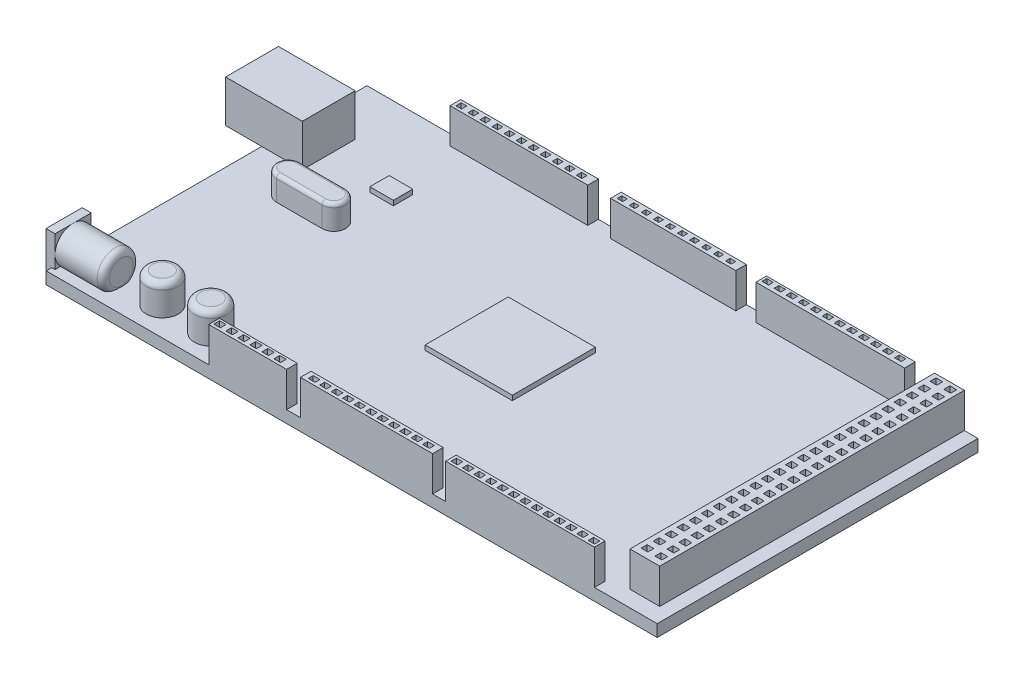
from build123d import *

# Parameters (mm, degrees)
SKETCH1_W            = 101.52
SKETCH1_H            = 53.3
BOSS_EXTRUDE1_DEPTH  = 2
SKETCH2_W            = 6.74838085
SKETCH2_H            = 8.78064323
BOSS_EXTRUDE2_DEPTH  = 7
SKETCH3_W            = 8.78064323
SKETCH3_H            = 7
BOSS_EXTRUDE3_DEPTH  = 6
SKETCH4_W            = 4.543302896
SKETCH4_H            = 1.024447778
CUT_EXTRUDE1_DEPTH   = 10
SKETCH5_R            = 3
BOSS_EXTRUDE4_DEPTH  = 8
FILLET1_R            = 1
SKETCH6_W            = 6
SKETCH6_H            = 6
BOSS_EXTRUDE6_DEPTH  = 1.5
SKETCH8_R            = 2.5
SKETCH8_R_2          = 0.349668819
CUT_EXTRUDE5_DEPTH   = 6
SKETCH9_R            = 2.653495426
SKETCH9_R_2          = 2.712578632
BOSS_EXTRUDE7_DEPTH  = 5
FILLET2_R            = 1
BOSS_EXTRUDE8_DEPTH  = 4
FILLET3_R            = 0.6
SKETCH11_W           = 14.481891317
SKETCH11_H           = 13.792277445
SKETCH11_W_2         = 3.907811942
SKETCH11_H_2         = 3.21819807
BOSS_EXTRUDE9_DEPTH  = 0.8
SKETCH12_W           = 22.872193429
SKETCH12_H           = 1.77
SKETCH12_W_2         = 20.803351813
SKETCH12_W_3         = 24.711163755
SKETCH12_W_4         = 4.942232752
SKETCH12_H_2         = 50.614069561
SKETCH12_W_5         = 21.952708267
SKETCH12_W_6         = 12.930260105
BOSS_EXTRUDE10_DEPTH = 5.8
SKETCH13_W           = 0.927290968
SKETCH13_H           = 0.87274444
CUT_EXTRUDE6_DEPTH   = 4.8
SKETCH14_W           = 0.905472357
SKETCH14_H           = 0.769651504
CUT_EXTRUDE7_DEPTH   = 3.8
SKETCH15_W           = 1.089735982
SKETCH15_H           = 0.789119159
CUT_EXTRUDE8_DEPTH   = 3.8
SKETCH17_W           = 1.087248378
SKETCH17_H           = 0.957814047
CUT_EXTRUDE9_DEPTH   = 3.8
SKETCH18_W           = 1.127313084
SKETCH18_H           = 0.826696262
CUT_EXTRUDE10_DEPTH  = 3.8
SKETCH19_W           = 1.047751564
SKETCH19_H           = 0.893670451
CUT_EXTRUDE11_DEPTH  = 3.8
SKETCH20_W           = 1.131840446
SKETCH20_H           = 0.996019593
CUT_EXTRUDE12_DEPTH  = 3.8


with BuildPart() as part:
    # Sketch1 → Boss-Extrude1 (new body)
    with BuildSketch(Plane(origin=(0, 0, 0), x_dir=(1, 0, 0), z_dir=(0, 1, 0))):
        with Locations((-2.786348449, 3.030668258)):
            Rectangle(SKETCH1_W, SKETCH1_H)
    extrude(amount=BOSS_EXTRUDE1_DEPTH)

    # Sketch2 → Boss-Extrude2 (add)
    with BuildSketch(Plane(origin=(0, 2, 0), x_dir=(1, 0, 0), z_dir=(0, 1, 0))):
        with Locations((-50.172158024, 16.581043612)):
            Rectangle(SKETCH2_W, SKETCH2_H)
    extrude(amount=BOSS_EXTRUDE2_DEPTH)

    # Sketch3 → Boss-Extrude3 (add)
    with BuildSketch(Plane.ZY.offset(53.546348449)):
        with Locations((-16.581043612, 5.5)):
            Rectangle(SKETCH3_W, SKETCH3_H)
    extrude(amount=BOSS_EXTRUDE3_DEPTH)

    # Sketch4 → Cut-Extrude1 (cut)
    with BuildSketch(Plane.ZY.offset(59.546348449)):
        Polygon((-14.309392164, 7.943282811), (-18.85269506, 7.943282811), (-20.446280493, 6.349697378), (-20.446280493, 2.991785215), (-12.71580673, 2.991785215), (-12.71580673, 6.349697378), align=None)
        with Locations((-16.581043612, 5.154508303)):
            Rectangle(SKETCH4_W, SKETCH4_H, mode=Mode.SUBTRACT)
    extrude(amount=-CUT_EXTRUDE1_DEPTH, mode=Mode.SUBTRACT)


with BuildPart() as body_2:
    # Sketch5 → Boss-Extrude4 (new body)
    with BuildSketch(Plane(origin=(-45, 0, 0), x_dir=(0, 0, -1), z_dir=(1, 0, 0))):
        with Locations((-19.694998297, 4.155671719)):
            Circle(SKETCH5_R)
    extrude(amount=-BOSS_EXTRUDE4_DEPTH)

    # Fillet1
    fillet1_edges = [body_2.edges().sort_by_distance(p)[0] for p in [
        (-45, 4.155671719, 22.694998297),
    ]]
    fillet(fillet1_edges, radius=FILLET1_R)


with BuildPart() as body_3:
    # Sketch6 → Boss-Extrude6 (new body)
    with BuildSketch(Plane.ZY.offset(53)):
        with Locations((19.694998297, 4.155671719)):
            Rectangle(SKETCH6_W, SKETCH6_H)
    extrude(amount=BOSS_EXTRUDE6_DEPTH)


with BuildPart() as cut_extrude5_tool:
    # Sketch8 → Cut-Extrude5 (new body)
    with BuildSketch(Plane.ZY.offset(54.5)):
        with Locations((19.694998297, 4.155671719)):
            Circle(SKETCH8_R)
        with Locations((19.694998297, 4.155671719)):
            Circle(SKETCH8_R_2, mode=Mode.SUBTRACT)
    extrude(amount=-CUT_EXTRUDE5_DEPTH)


with BuildPart() as part_1:
    add(part.part)

    # Cut-Extrude5: cut by cut_extrude5_tool
    add(cut_extrude5_tool.part, mode=Mode.SUBTRACT)

    # Sketch9 → Boss-Extrude7 (add)
    with BuildSketch(Plane(origin=(0, 2, 0), x_dir=(1, 0, 0), z_dir=(0, 1, 0))):
        with Locations(Location((-39.002762462, -18.864559686, 0), (0, 0, 270))):
            Circle(SKETCH9_R)
        with Locations(Location((-30.957267285, -18.864559686, 0), (0, 0, 270))):
            Circle(SKETCH9_R_2)
    extrude(amount=BOSS_EXTRUDE7_DEPTH)

    # Fillet2
    fillet2_edges = [part_1.edges().sort_by_distance(p)[0] for p in [
        (-39.002762462, 7, 16.21106426),
        (-30.957267285, 7, 16.151981054),
    ]]
    fillet(fillet2_edges, radius=FILLET2_R)

    # Sketch10 → Boss-Extrude8 (add)
    with BuildSketch(Plane(origin=(0, 2, 0), x_dir=(1, 0, 0), z_dir=(0, 1, 0))):
        with BuildLine():
            Line((-44.289802149, 9.294673431), (-36.704049554, 9.294673431))
            ThreePointArc((-36.704049554, 9.294673431), (-34.750143583, 7.340767459), (-36.704049554, 5.386861488))
            Line((-36.704049554, 5.386861488), (-44.289802149, 5.386861488))
            ThreePointArc((-44.289802149, 5.386861488), (-46.24370812, 7.340767459), (-44.289802149, 9.294673431))
        make_face()
    extrude(amount=BOSS_EXTRUDE8_DEPTH)

    # Fillet3
    fillet3_edges = [part_1.edges().sort_by_distance(p)[0] for p in [
        (-46.24370812, 6, -7.340767459),
        (-40.496925851, 6, -5.386861488),
        (-34.750143583, 6, -7.340767459),
        (-40.496925851, 6, -9.294673431),
    ]]
    fillet(fillet3_edges, radius=FILLET3_R)

    # Sketch11 → Boss-Extrude9 (add)
    with BuildSketch(Plane(origin=(0, 2, 0), x_dir=(1, 0, 0), z_dir=(0, 1, 0))):
        with Locations((-3.372712395, 3.318019872)):
            Rectangle(SKETCH11_W, SKETCH11_H)
        with Locations((-36.014435682, 16.190812153)):
            Rectangle(SKETCH11_W_2, SKETCH11_H_2)
    extrude(amount=BOSS_EXTRUDE9_DEPTH)

    # Sketch12 → Boss-Extrude10 (add)
    with BuildSketch(Plane(origin=(0, 2, 0), x_dir=(1, 0, 0), z_dir=(0, 1, 0))):
        with Locations((-26.532244938, 28.795668258)):
            Rectangle(SKETCH12_W, SKETCH12_H)
        with Locations((-0.901596021, 28.795668258)):
            Rectangle(SKETCH12_W_2, SKETCH12_H)
        with Locations((25.18879548, 28.795668258)):
            Rectangle(SKETCH12_W_3, SKETCH12_H)
        with Locations((43.233691803, 4.373633478)):
            Rectangle(SKETCH12_W_4, SKETCH12_H_2)
        with Locations((25.18879548, -22.734331742)):
            Rectangle(SKETCH12_W_3, SKETCH12_H)
        with Locations((-0.326917793, -22.734331742)):
            Rectangle(SKETCH12_W_5, SKETCH12_H)
        with Locations((-20.067114887, -22.734331742)):
            Rectangle(SKETCH12_W_6, SKETCH12_H)
    extrude(amount=BOSS_EXTRUDE10_DEPTH)

    # Sketch13 → Cut-Extrude6 (cut)
    with BuildSketch(Plane(origin=(0, 7.8, 0), x_dir=(1, 0, 0), z_dir=(0, 1, 0))):
        with Locations((-34.99503549, 28.806813689)):
            Rectangle(SKETCH13_W, SKETCH13_H)
        with Locations((-36.99503549, 28.806813689)):
            Rectangle(SKETCH13_W, SKETCH13_H)
        with Locations((-32.99503549, 28.806813689)):
            Rectangle(SKETCH13_W, SKETCH13_H)
        with Locations((-30.99503549, 28.806813689)):
            Rectangle(SKETCH13_W, SKETCH13_H)
        with Locations((-28.99503549, 28.806813689)):
            Rectangle(SKETCH13_W, SKETCH13_H)
        with Locations((-26.99503549, 28.806813689)):
            Rectangle(SKETCH13_W, SKETCH13_H)
        with Locations((-24.99503549, 28.806813689)):
            Rectangle(SKETCH13_W, SKETCH13_H)
        with Locations((-22.99503549, 28.806813689)):
            Rectangle(SKETCH13_W, SKETCH13_H)
        with Locations((-20.99503549, 28.806813689)):
            Rectangle(SKETCH13_W, SKETCH13_H)
        with Locations((-18.99503549, 28.806813689)):
            Rectangle(SKETCH13_W, SKETCH13_H)
        with Locations((-16.99503549, 28.806813689)):
            Rectangle(SKETCH13_W, SKETCH13_H)
    extrude(amount=-CUT_EXTRUDE6_DEPTH, mode=Mode.SUBTRACT)

    # Sketch14 → Cut-Extrude7 (cut)
    with BuildSketch(Plane(origin=(0, 7.8, 0), x_dir=(1, 0, 0), z_dir=(0, 1, 0))):
        with Locations((-8.279975456, 28.830261771)):
            Rectangle(SKETCH14_W, SKETCH14_H)
        with Locations((-10.279975456, 28.830261771)):
            Rectangle(SKETCH14_W, SKETCH14_H)
        with Locations((-6.279975456, 28.830261771)):
            Rectangle(SKETCH14_W, SKETCH14_H)
        with Locations((-4.279975456, 28.830261771)):
            Rectangle(SKETCH14_W, SKETCH14_H)
        with Locations((-2.279975456, 28.830261771)):
            Rectangle(SKETCH14_W, SKETCH14_H)
        with Locations((-0.279975456, 28.830261771)):
            Rectangle(SKETCH14_W, SKETCH14_H)
        with Locations((1.720024545, 28.830261771)):
            Rectangle(SKETCH14_W, SKETCH14_H)
        with Locations((3.720024545, 28.830261771)):
            Rectangle(SKETCH14_W, SKETCH14_H)
        with Locations((5.720024545, 28.830261771)):
            Rectangle(SKETCH14_W, SKETCH14_H)
        with Locations((7.720024545, 28.830261771)):
            Rectangle(SKETCH14_W, SKETCH14_H)
    extrude(amount=-CUT_EXTRUDE7_DEPTH, mode=Mode.SUBTRACT)

    # Sketch15 → Cut-Extrude8 (cut)
    with BuildSketch(Plane(origin=(0, 7.8, 0), x_dir=(1, 0, 0), z_dir=(0, 1, 0))):
        with Locations((15.773973887, 28.943664547)):
            Rectangle(SKETCH15_W, SKETCH15_H)
        with Locations((13.773973887, 28.943664547)):
            Rectangle(SKETCH15_W, SKETCH15_H)
        with Locations((17.773973887, 28.943664547)):
            Rectangle(SKETCH15_W, SKETCH15_H)
        with Locations((19.773973887, 28.943664547)):
            Rectangle(SKETCH15_W, SKETCH15_H)
        with Locations((21.773973887, 28.943664547)):
            Rectangle(SKETCH15_W, SKETCH15_H)
        with Locations((23.773973887, 28.943664547)):
            Rectangle(SKETCH15_W, SKETCH15_H)
        with Locations((25.773973887, 28.943664547)):
            Rectangle(SKETCH15_W, SKETCH15_H)
        with Locations((27.773973887, 28.943664547)):
            Rectangle(SKETCH15_W, SKETCH15_H)
        with Locations((29.773973887, 28.943664547)):
            Rectangle(SKETCH15_W, SKETCH15_H)
        with Locations((31.773973887, 28.943664547)):
            Rectangle(SKETCH15_W, SKETCH15_H)
        with Locations((33.773973887, 28.943664547)):
            Rectangle(SKETCH15_W, SKETCH15_H)
        with Locations((35.773973887, 28.943664547)):
            Rectangle(SKETCH15_W, SKETCH15_H)
    extrude(amount=-CUT_EXTRUDE8_DEPTH, mode=Mode.SUBTRACT)

    # Sketch17 → Cut-Extrude9 (cut)
    with BuildSketch(Plane(origin=(0, 7.8, 0), x_dir=(1, 0, 0), z_dir=(0, 1, 0))):
        with Locations((-23.627930838, -22.669635852)):
            Rectangle(SKETCH17_W, SKETCH17_H)
        with Locations((-25.627930838, -22.669635852)):
            Rectangle(SKETCH17_W, SKETCH17_H)
        with Locations((-21.627930838, -22.669635852)):
            Rectangle(SKETCH17_W, SKETCH17_H)
        with Locations((-19.627930838, -22.669635852)):
            Rectangle(SKETCH17_W, SKETCH17_H)
        with Locations((-17.627930838, -22.669635852)):
            Rectangle(SKETCH17_W, SKETCH17_H)
        with Locations((-15.627930838, -22.669635852)):
            Rectangle(SKETCH17_W, SKETCH17_H)
    extrude(amount=-CUT_EXTRUDE9_DEPTH, mode=Mode.SUBTRACT)

    # Sketch18 → Cut-Extrude10 (cut)
    with BuildSketch(Plane(origin=(0, 7.8, 0), x_dir=(1, 0, 0), z_dir=(0, 1, 0))):
        with Locations((-8.036156834, -22.710778398)):
            Rectangle(SKETCH18_W, SKETCH18_H)
        with Locations((-9.936156834, -22.710778398)):
            Rectangle(SKETCH18_W, SKETCH18_H)
        with Locations((-6.136156834, -22.710778398)):
            Rectangle(SKETCH18_W, SKETCH18_H)
        with Locations((-4.236156834, -22.710778398)):
            Rectangle(SKETCH18_W, SKETCH18_H)
        with Locations((-2.336156834, -22.710778398)):
            Rectangle(SKETCH18_W, SKETCH18_H)
        with Locations((-0.436156834, -22.710778398)):
            Rectangle(SKETCH18_W, SKETCH18_H)
        with Locations((1.463843166, -22.710778398)):
            Rectangle(SKETCH18_W, SKETCH18_H)
        with Locations((3.363843166, -22.710778398)):
            Rectangle(SKETCH18_W, SKETCH18_H)
        with Locations((5.263843166, -22.710778398)):
            Rectangle(SKETCH18_W, SKETCH18_H)
        with Locations((7.163843166, -22.710778398)):
            Rectangle(SKETCH18_W, SKETCH18_H)
        with Locations((9.063843166, -22.710778398)):
            Rectangle(SKETCH18_W, SKETCH18_H)
    extrude(amount=-CUT_EXTRUDE10_DEPTH, mode=Mode.SUBTRACT)

    # Sketch19 → Cut-Extrude11 (cut)
    with BuildSketch(Plane(origin=(0, 7.8, 0), x_dir=(1, 0, 0), z_dir=(0, 1, 0))):
        with Locations((15.696618829, -22.731537289)):
            Rectangle(SKETCH19_W, SKETCH19_H)
        with Locations((13.796618829, -22.731537289)):
            Rectangle(SKETCH19_W, SKETCH19_H)
        with Locations((17.596618829, -22.731537289)):
            Rectangle(SKETCH19_W, SKETCH19_H)
        with Locations((19.496618829, -22.731537289)):
            Rectangle(SKETCH19_W, SKETCH19_H)
        with Locations((21.396618829, -22.731537289)):
            Rectangle(SKETCH19_W, SKETCH19_H)
        with Locations((23.296618829, -22.731537289)):
            Rectangle(SKETCH19_W, SKETCH19_H)
        with Locations((25.196618829, -22.731537289)):
            Rectangle(SKETCH19_W, SKETCH19_H)
        with Locations((27.096618829, -22.731537289)):
            Rectangle(SKETCH19_W, SKETCH19_H)
        with Locations((28.996618829, -22.731537289)):
            Rectangle(SKETCH19_W, SKETCH19_H)
        with Locations((30.896618829, -22.731537289)):
            Rectangle(SKETCH19_W, SKETCH19_H)
        with Locations((32.796618829, -22.731537289)):
            Rectangle(SKETCH19_W, SKETCH19_H)
        with Locations((34.696618829, -22.731537289)):
            Rectangle(SKETCH19_W, SKETCH19_H)
        with Locations((36.596618829, -22.731537289)):
            Rectangle(SKETCH19_W, SKETCH19_H)
    extrude(amount=-CUT_EXTRUDE11_DEPTH, mode=Mode.SUBTRACT)

    # Sketch20 → Cut-Extrude12 (cut)
    with BuildSketch(Plane(origin=(0, 7.8, 0), x_dir=(1, 0, 0), z_dir=(0, 1, 0))):
        with Locations((44.42776347, 28.61232489)):
            Rectangle(SKETCH20_W, SKETCH20_H)
        with Locations((42.12776347, 28.61232489)):
            Rectangle(SKETCH20_W, SKETCH20_H)
        with Locations((44.42776347, 26.61232489)):
            Rectangle(SKETCH20_W, SKETCH20_H)
        with Locations((44.42776347, 24.61232489)):
            Rectangle(SKETCH20_W, SKETCH20_H)
        with Locations((44.42776347, 22.61232489)):
            Rectangle(SKETCH20_W, SKETCH20_H)
        with Locations((44.42776347, 20.61232489)):
            Rectangle(SKETCH20_W, SKETCH20_H)
        with Locations((44.42776347, 18.61232489)):
            Rectangle(SKETCH20_W, SKETCH20_H)
        with Locations((44.42776347, 16.61232489)):
            Rectangle(SKETCH20_W, SKETCH20_H)
        with Locations((44.42776347, 14.61232489)):
            Rectangle(SKETCH20_W, SKETCH20_H)
        with Locations((44.42776347, 12.61232489)):
            Rectangle(SKETCH20_W, SKETCH20_H)
        with Locations((44.42776347, 10.612324889)):
            Rectangle(SKETCH20_W, SKETCH20_H)
        with Locations((44.42776347, 8.612324889)):
            Rectangle(SKETCH20_W, SKETCH20_H)
        with Locations((44.42776347, 6.612324889)):
            Rectangle(SKETCH20_W, SKETCH20_H)
        with Locations((44.42776347, 4.612324889)):
            Rectangle(SKETCH20_W, SKETCH20_H)
        with Locations((44.42776347, 2.612324889)):
            Rectangle(SKETCH20_W, SKETCH20_H)
        with Locations((44.42776347, 0.61232489)):
            Rectangle(SKETCH20_W, SKETCH20_H)
        with Locations((44.42776347, -1.387675111)):
            Rectangle(SKETCH20_W, SKETCH20_H)
        with Locations((44.42776347, -3.387675111)):
            Rectangle(SKETCH20_W, SKETCH20_H)
        with Locations((44.42776347, -5.387675111)):
            Rectangle(SKETCH20_W, SKETCH20_H)
        with Locations((44.42776347, -7.387675111)):
            Rectangle(SKETCH20_W, SKETCH20_H)
        with Locations((44.42776347, -9.387675111)):
            Rectangle(SKETCH20_W, SKETCH20_H)
        with Locations((44.42776347, -11.387675111)):
            Rectangle(SKETCH20_W, SKETCH20_H)
        with Locations((44.42776347, -13.387675111)):
            Rectangle(SKETCH20_W, SKETCH20_H)
        with Locations((44.42776347, -15.387675111)):
            Rectangle(SKETCH20_W, SKETCH20_H)
        with Locations((44.42776347, -17.387675111)):
            Rectangle(SKETCH20_W, SKETCH20_H)
        with Locations((44.42776347, -19.387675111)):
            Rectangle(SKETCH20_W, SKETCH20_H)
        with Locations((42.12776347, 26.61232489)):
            Rectangle(SKETCH20_W, SKETCH20_H)
        with Locations((42.12776347, 24.61232489)):
            Rectangle(SKETCH20_W, SKETCH20_H)
        with Locations((42.12776347, 22.61232489)):
            Rectangle(SKETCH20_W, SKETCH20_H)
        with Locations((42.12776347, 20.61232489)):
            Rectangle(SKETCH20_W, SKETCH20_H)
        with Locations((42.12776347, 18.61232489)):
            Rectangle(SKETCH20_W, SKETCH20_H)
        with Locations((42.12776347, 16.61232489)):
            Rectangle(SKETCH20_W, SKETCH20_H)
        with Locations((42.12776347, 14.61232489)):
            Rectangle(SKETCH20_W, SKETCH20_H)
        with Locations((42.12776347, 12.61232489)):
            Rectangle(SKETCH20_W, SKETCH20_H)
        with Locations((42.12776347, 10.612324889)):
            Rectangle(SKETCH20_W, SKETCH20_H)
        with Locations((42.12776347, 8.612324889)):
            Rectangle(SKETCH20_W, SKETCH20_H)
        with Locations((42.12776347, 6.612324889)):
            Rectangle(SKETCH20_W, SKETCH20_H)
        with Locations((42.12776347, 4.612324889)):
            Rectangle(SKETCH20_W, SKETCH20_H)
        with Locations((42.12776347, 2.612324889)):
            Rectangle(SKETCH20_W, SKETCH20_H)
        with Locations((42.12776347, 0.61232489)):
            Rectangle(SKETCH20_W, SKETCH20_H)
        with Locations((42.12776347, -1.387675111)):
            Rectangle(SKETCH20_W, SKETCH20_H)
        with Locations((42.12776347, -3.387675111)):
            Rectangle(SKETCH20_W, SKETCH20_H)
        with Locations((42.12776347, -5.387675111)):
            Rectangle(SKETCH20_W, SKETCH20_H)
        with Locations((42.12776347, -7.387675111)):
            Rectangle(SKETCH20_W, SKETCH20_H)
        with Locations((42.12776347, -9.387675111)):
            Rectangle(SKETCH20_W, SKETCH20_H)
        with Locations((42.12776347, -11.387675111)):
            Rectangle(SKETCH20_W, SKETCH20_H)
        with Locations((42.12776347, -13.387675111)):
            Rectangle(SKETCH20_W, SKETCH20_H)
        with Locations((42.12776347, -15.387675111)):
            Rectangle(SKETCH20_W, SKETCH20_H)
        with Locations((42.12776347, -17.387675111)):
            Rectangle(SKETCH20_W, SKETCH20_H)
        with Locations((42.12776347, -19.387675111)):
            Rectangle(SKETCH20_W, SKETCH20_H)
    extrude(amount=-CUT_EXTRUDE12_DEPTH, mode=Mode.SUBTRACT)


with BuildPart() as body_2_1:
    add(body_2.part)

    # Cut-Extrude5: cut by cut_extrude5_tool
    add(cut_extrude5_tool.part, mode=Mode.SUBTRACT)


with BuildPart() as body_3_1:
    add(body_3.part)

    # Cut-Extrude5: cut by cut_extrude5_tool
    add(cut_extrude5_tool.part, mode=Mode.SUBTRACT)


solid = Compound([part_1.part, body_2_1.part, body_3_1.part])
